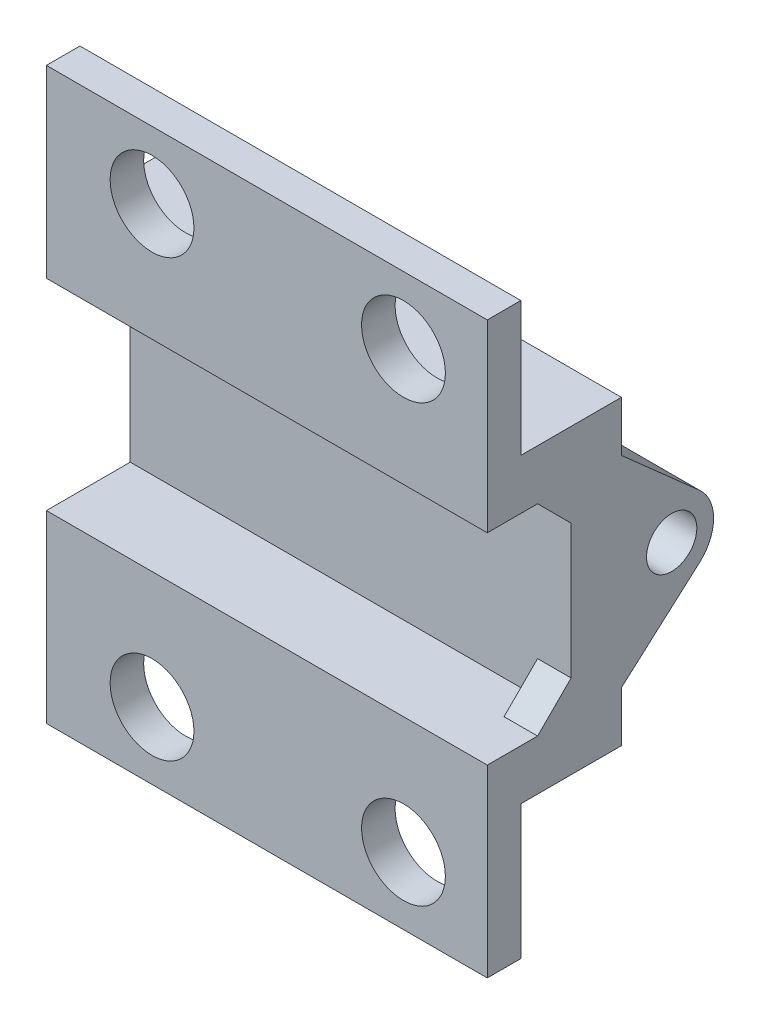
from build123d import *

# Parameters (mm, degrees)
SKETCH_1_W          = 24.3
SKETCH_1_H          = 3
EXTRUDE_1_DEPTH     = 5
EXTRUDE_1_2_DEPTH   = 5
SKETCH_2_W          = 24.3
SKETCH_2_H          = 18
EXTRUDE_2_DEPTH     = 3
EXTRUDE_3_DEPTH     = 2
EXTRUDE_5_DEPTH     = 6
SKETCH_7_W          = 2
SKETCH_7_H          = 8
EXTRUDE_6_DEPTH     = 26.3
SKETCH_8_R          = 2.5
CUT_EXTRUDE_2_DEPTH = 2


with BuildPart() as part:
    # Эскиз1 → Бобышка-Вытянуть1 (new body)
    with BuildSketch(Plane.XY):
        with Locations((0, 7.5)):
            Rectangle(SKETCH_1_W, SKETCH_1_H)
    extrude(amount=EXTRUDE_1_DEPTH)



with BuildPart() as body_2:
    # Эскиз1 → Extrude 1 2 (new body)
    with BuildSketch(Plane.XY):
        with Locations((0, -7.5)):
            Rectangle(SKETCH_1_W, SKETCH_1_H)
    extrude(amount=EXTRUDE_1_2_DEPTH)


with BuildPart() as body_3:
    # Эскиз2 → Бобышка-Вытянуть2 (new body)
    with BuildSketch(Plane(origin=(0, 0, 0), x_dir=(-1, 0, 0), z_dir=(0, 0, -1))):
        Rectangle(SKETCH_2_W, SKETCH_2_H)
    extrude(amount=EXTRUDE_2_DEPTH)


with BuildPart() as part_1:
    add(part.part)

    add(body_2.part)  # Бобышка-Вытянуть3 merges body 2

    add(body_3.part)  # Бобышка-Вытянуть3 merges body 3
    # Эскиз3 → Бобышка-Вытянуть3 (add)
    with BuildSketch(Plane(origin=(12.15, 0, 0), x_dir=(0, 0, -1), z_dir=(1, 0, 0))):
        Polygon((-5, 6), (-5, 9), (3, 9), (3, -9), (-5, -9), (-5, -6), (-2, -6), (0, -4), (0, 4), (-2, 6), align=None)
    extrude(amount=EXTRUDE_3_DEPTH)

    # Эскиз6 → Бобышка-Вытянуть5 (add)
    with BuildSketch(Plane(origin=(14.15, 0, 0), x_dir=(0, 0, -1), z_dir=(1, 0, 0))):
        with BuildLine():
            Line((7.6583166, 1.870824966), (3, 6))
            Line((3, 6), (3, 0))
            Line((3, 0), (3.5, 0))
            ThreePointArc((3.5, 0), (4.974278668, 2.279889416), (7.6583166, 1.870824966))
        make_face()
        with BuildLine():
            ThreePointArc((8.5, 0), (8.279889416, 1.025721332), (7.6583166, 1.870824966))
            ThreePointArc((7.6583166, 1.870824966), (4.974278668, 2.279889416), (3.5, 0))
            Line((3.5, 0), (4.5, 0))
            ThreePointArc((4.5, 0), (6, 1.5), (7.5, 0))
            Line((7.5, 0), (8.5, 0))
        make_face()
        with BuildLine():
            ThreePointArc((7.6583166, -1.870824966), (8.279889416, -1.025721332), (8.5, 0))
            Line((8.5, 0), (7.5, 0))
            ThreePointArc((7.5, 0), (6, -1.5), (4.5, 0))
            Line((4.5, 0), (3.5, 0))
            ThreePointArc((3.5, 0), (4.974278668, -2.279889416), (7.6583166, -1.870824966))
        make_face()
        with BuildLine():
            Line((3.5, 0), (3, 0))
            Line((3, 0), (3, -6))
            Line((3, -6), (7.6583166, -1.870824966))
            ThreePointArc((7.6583166, -1.870824966), (4.974278668, -2.279889416), (3.5, 0))
        make_face()
    extrude(amount=-EXTRUDE_5_DEPTH)

    # Эскиз7 → Бобышка-Вытянуть6 (add)
    with BuildSketch(Plane(origin=(14.15, 0, 0), x_dir=(0, 0, -1), z_dir=(1, 0, 0))):
        with Locations((-4, 13)):
            Rectangle(SKETCH_7_W, SKETCH_7_H)
        with Locations((-4, -13)):
            Rectangle(SKETCH_7_W, SKETCH_7_H)
    extrude(amount=-EXTRUDE_6_DEPTH)

    # Эскиз8 → Вырез-Вытянуть2 (cut)
    with BuildSketch(Plane(origin=(0, 0, 3), x_dir=(-1, 0, 0), z_dir=(0, 0, -1))):
        with Locations((5.85, -13)):
            Circle(SKETCH_8_R)
        with Locations((-9.15, -13)):
            Circle(SKETCH_8_R)
        with Locations((-9.15, 13)):
            Circle(SKETCH_8_R)
        with Locations((5.85, 13)):
            Circle(SKETCH_8_R)
    extrude(amount=-CUT_EXTRUDE_2_DEPTH, mode=Mode.SUBTRACT)


solid = part_1.part
